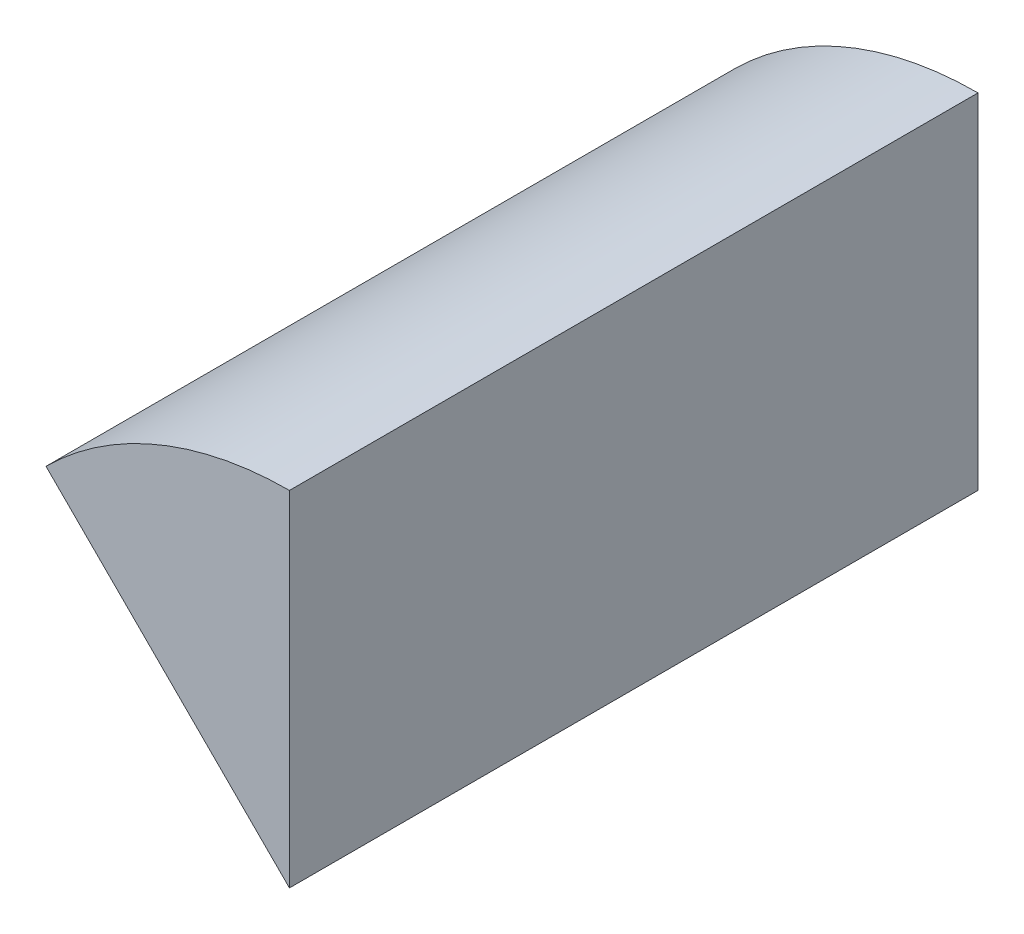
from build123d import *

# Parameters (mm, degrees)
SALIENTE_EXTRUIR1_DEPTH = 50
CROQUIS2_R              = 5
CORTAR_EXTRUIR1_DEPTH   = 10


with BuildPart() as part:
    # Croquis1 → Saliente-Extruir1 (new body)
    with BuildSketch(Plane.XY):
        with BuildLine():
            Line((0, 25), (0, 0))
            Line((0, 0), (-17.67766953, 17.67766953))
            ThreePointArc((-17.67766953, 17.67766953), (-9.567085809, 23.096988313), (0, 25))
        make_face()
    extrude(amount=SALIENTE_EXTRUIR1_DEPTH)

    # Croquis2 → Cortar-Extruir1 (cut)
    with BuildSketch(Plane(origin=(0, 0, 0), x_dir=(-1, 0, 0), z_dir=(0, 0, -1))):
        with Locations((6.59443803, 16.741529423)):
            Circle(CROQUIS2_R)
    extrude(amount=-CORTAR_EXTRUIR1_DEPTH, mode=Mode.SUBTRACT)


solid = part.part
